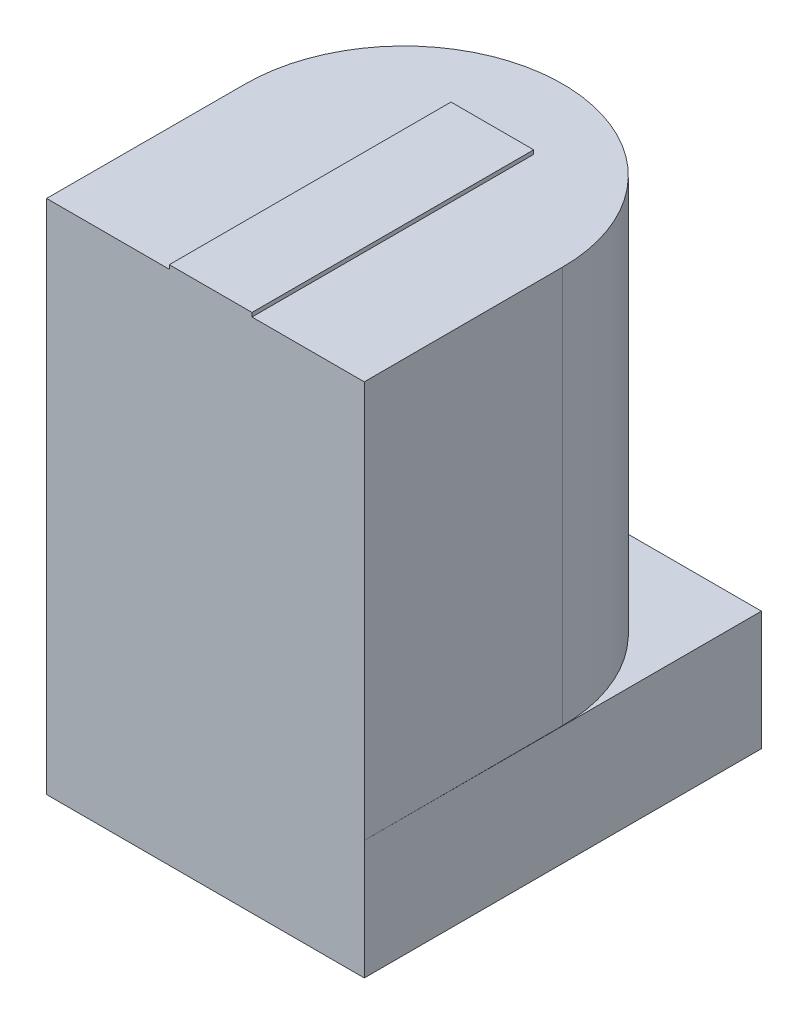
from build123d import *

# Parameters (mm, degrees)
SKETCH_1_W          = 8
SKETCH_1_H          = 10
EXTRUDE_1_DEPTH     = 3
EXTRUDE_2_DEPTH     = 10
SKETCH_3_R          = 2.5
CUT_EXTRUDE_1_DEPTH = 10
SKETCH_4_W          = 2.082831863
SKETCH_4_H          = 7.092942697
EXTRUDE_3_DEPTH     = 0.1


with BuildPart() as part:
    # 草图1 → 凸台-拉伸1 (new body)
    with BuildSketch(Plane(origin=(0, 0, 0), x_dir=(1, 0, 0), z_dir=(0, 1, 0))):
        with Locations((4, 5)):
            Rectangle(SKETCH_1_W, SKETCH_1_H)
    extrude(amount=EXTRUDE_1_DEPTH)

    # 草图2 → 凸台-拉伸2 (add)
    with BuildSketch(Plane(origin=(0, 3, 0), x_dir=(1, 0, 0), z_dir=(0, 1, 0))):
        with BuildLine():
            Line((0.005966473, 5), (0, 0))
            Line((0, 0), (8, 0))
            Line((8, 0), (7.994033527, 5))
            ThreePointArc((7.994033527, 5), (4, 8.994033527), (0.005966473, 5))
        make_face()
    extrude(amount=EXTRUDE_2_DEPTH)

    # 草图3 → 切除-拉伸1 (cut)
    with BuildSketch(Plane.XZ):
        with Locations(Location((4, -5.512337614, 0), (0, 0, 270))):
            Circle(SKETCH_3_R)
    extrude(amount=-CUT_EXTRUDE_1_DEPTH, mode=Mode.SUBTRACT)

    # 草图4 → 凸台-拉伸3 (add)
    with BuildSketch(Plane(origin=(0, 13, 0), x_dir=(1, 0, 0), z_dir=(0, 1, 0))):
        with Locations((4.131440846, 3.546471349)):
            Rectangle(SKETCH_4_W, SKETCH_4_H)
    extrude(amount=EXTRUDE_3_DEPTH)


solid = part.part
